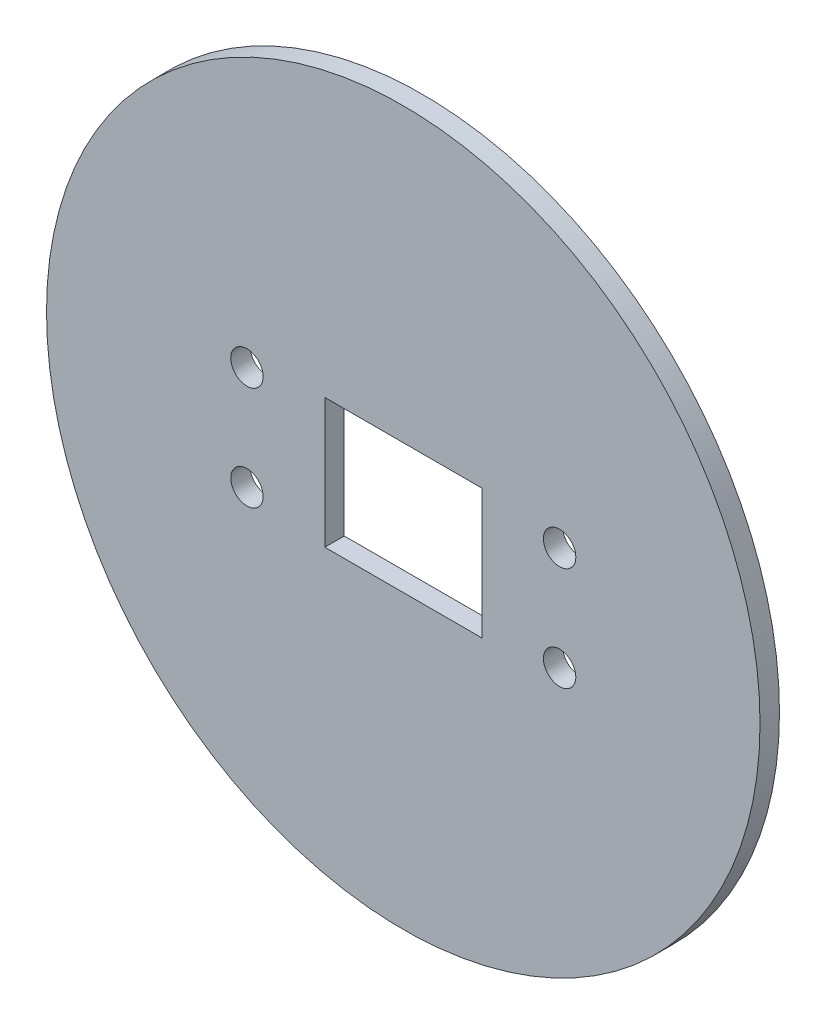
from build123d import *

# Parameters (mm, degrees)
SKETCH_2_R          = 27.5
SKETCH_2_W          = 12.1
SKETCH_2_H          = 10
EXTRUDE_2_DEPTH     = 1.5
SKETCH_3_R          = 1.25
CUT_EXTRUDE_1_DEPTH = 10


with BuildPart() as part:
    # 草图2 → 凸台-拉伸2 (new body)
    with BuildSketch(Plane.XY):
        Circle(SKETCH_2_R)
        Rectangle(SKETCH_2_W, SKETCH_2_H, mode=Mode.SUBTRACT)
    extrude(amount=EXTRUDE_2_DEPTH)

    # 草图3 → 切除-拉伸1 (cut)
    with BuildSketch(Plane.XY.offset(1.5)):
        with Locations((12.05, 4)):
            Circle(SKETCH_3_R)
        with Locations((-12.05, 4)):
            Circle(SKETCH_3_R)
        with Locations((12.05, -4)):
            Circle(SKETCH_3_R)
        with Locations((-12.05, -4)):
            Circle(SKETCH_3_R)
    extrude(amount=-CUT_EXTRUDE_1_DEPTH, mode=Mode.SUBTRACT)


solid = part.part
